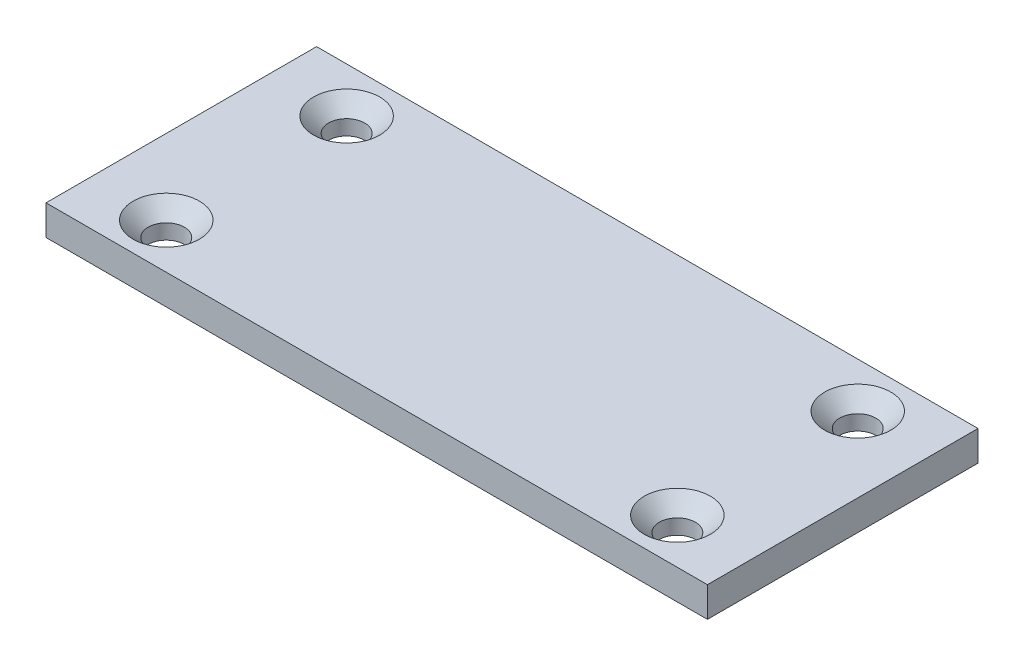
from build123d import *

# Parameters (mm, degrees)
SKETCH1_W                                       = 44
SKETCH1_H                                       = 18
BOSS_EXTRUDE1_DEPTH                             = 2
CSK_FOR_M2_FLAT_HEAD_MACHINE_SCREW1_D           = 2.4
CSK_FOR_M2_FLAT_HEAD_MACHINE_SCREW1_DEPTH       = 10
CSK_FOR_M2_FLAT_HEAD_MACHINE_SCREW1_CSINK_D     = 4.4
CSK_FOR_M2_FLAT_HEAD_MACHINE_SCREW1_CSINK_ANGLE = 90
CSK_FOR_M2_FLAT_HEAD_MACHINE_SCREW1_TIP         = 0.721032743


with BuildPart() as part:
    # Sketch1 → Boss-Extrude1 (new body)
    with BuildSketch(Plane(origin=(0, 0, 0), x_dir=(1, 0, 0), z_dir=(0, 1, 0))):
        Rectangle(SKETCH1_W, SKETCH1_H)
    extrude(amount=BOSS_EXTRUDE1_DEPTH)

    # CSK for M2 Flat Head Machine Screw1
    with Locations(Plane(origin=(0, 2, 0), x_dir=(1, 0, 0), z_dir=(0, 1, 0))):
        with Locations((-17, 6), (17, 6), (-17, -6), (17, -6)):
            CounterSinkHole(CSK_FOR_M2_FLAT_HEAD_MACHINE_SCREW1_D / 2, CSK_FOR_M2_FLAT_HEAD_MACHINE_SCREW1_CSINK_D / 2, depth=CSK_FOR_M2_FLAT_HEAD_MACHINE_SCREW1_DEPTH, counter_sink_angle=CSK_FOR_M2_FLAT_HEAD_MACHINE_SCREW1_CSINK_ANGLE)
            with Locations((0, 0, -(CSK_FOR_M2_FLAT_HEAD_MACHINE_SCREW1_DEPTH + CSK_FOR_M2_FLAT_HEAD_MACHINE_SCREW1_TIP / 2))):  # 118° drill point
                Cone(0, CSK_FOR_M2_FLAT_HEAD_MACHINE_SCREW1_D / 2, CSK_FOR_M2_FLAT_HEAD_MACHINE_SCREW1_TIP, mode=Mode.SUBTRACT)


solid = part.part
